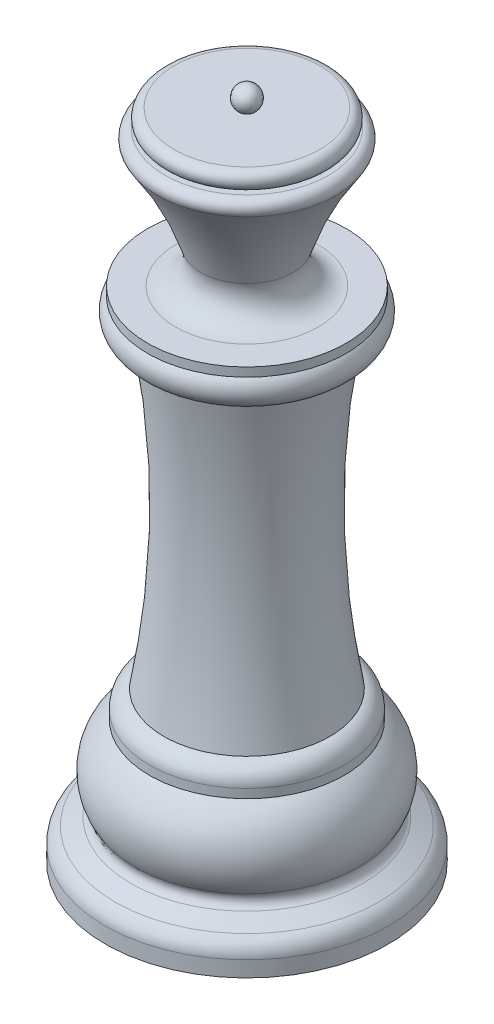
from build123d import *

# Parameters (mm, degrees)
FILLET1_R = 2
FILLET2_R = 1
FILLET3_R = 3
FILLET4_R = 1


with BuildPart() as part:
    # Sketch1 → Revolve1 (revolve)
    with BuildSketch(Plane.XY, mode=Mode.PRIVATE) as revolve1_sk:
        with BuildLine():
            Line((-0.021373291, 65.998238541), (-0.021373291, -10))
            Line((-0.021373291, -10), (13.959412098, -10))
            Line((13.959412098, -10), (15.959412098, -10))
            Line((15.959412098, -10), (15.959412098, -7))
            Line((15.959412098, -7), (11.991992379, -5))
            ThreePointArc((11.991992379, -5), (13.510901064, -0.280718375), (10.959412098, 3.97))
            Line((10.959412098, 3.97), (10.959412098, 4.97))
            ThreePointArc((10.959412098, 4.97), (10.516317431, 6.263451807), (9.345787589, 6.97))
            ThreePointArc((9.345787589, 6.97), (7.720871608, 24.46279186), (9.182303149, 41.97))
            ThreePointArc((9.182303149, 41.97), (11.471998628, 42.853075013), (11.182303149, 45.29))
            Line((11.182303149, 45.29), (11.182303149, 46.29))
            Line((11.182303149, 46.29), (4.182303149, 46.29))
            ThreePointArc((4.182303149, 46.29), (6.76997216, 54.409426796), (11.182303149, 61.7))
            Line((11.182303149, 61.7), (8.182303149, 61.7))
            ThreePointArc((8.182303149, 61.7), (9.182303149, 62.7), (8.182303149, 63.7))
            Line((8.182303149, 63.7), (0.882303149, 63.7))
            ThreePointArc((0.882303149, 63.7), (1.211868305, 65.156370153), (-0.021373291, 65.998238541))
        make_face()
    revolve(revolve1_sk.sketch.rotate(Axis((-0.021373291, 65.998238541, 0), (0, -1, 0)), 180), axis=Axis((-0.021373291, 65.998238541, 0), (0, -1, 0)))

    # Fillet1
    fillet1_edges = [part.edges().sort_by_distance(p)[0] for p in [
        (15.959412098, -7, 0),
    ]]
    fillet(fillet1_edges, radius=FILLET1_R)

    # Fillet2
    fillet2_edges = [part.edges().sort_by_distance(p)[0] for p in [
        (11.991992379, -5, 0),
    ]]
    fillet(fillet2_edges, radius=FILLET2_R)

    # Fillet3
    fillet3_edges = [part.edges().sort_by_distance(p)[0] for p in [
        (4.182303149, 46.29, 0),
    ]]
    fillet(fillet3_edges, radius=FILLET3_R)

    # Fillet4
    fillet4_edges = [part.edges().sort_by_distance(p)[0] for p in [
        (11.182303149, 61.7, 0),
    ]]
    fillet(fillet4_edges, radius=FILLET4_R)


solid = part.part
